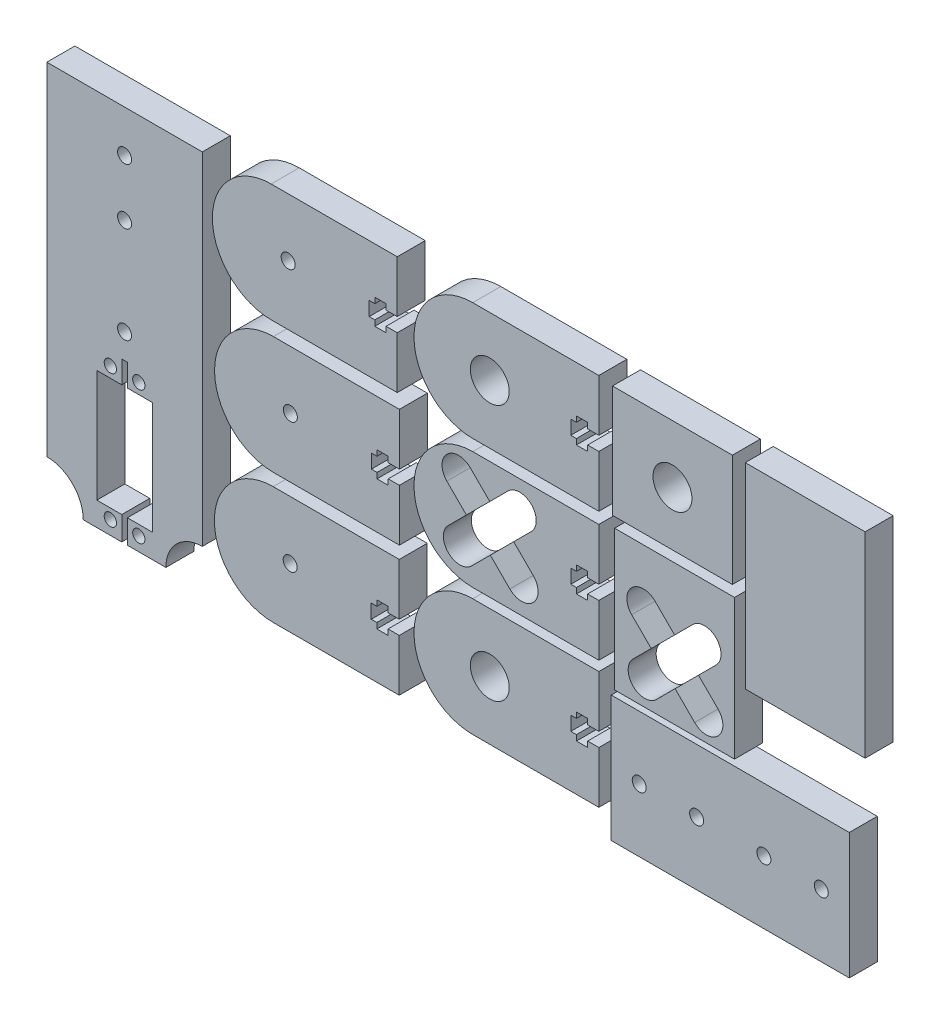
from build123d import *

# Parameters (mm, degrees)
SKETCH1_R              = 2.5
BOSS_EXTRUDE1_DEPTH    = 10
BOSS_EXTRUDE1_2_DEPTH  = 10
SKETCH1_R_2            = 6.95
BOSS_EXTRUDE1_3_DEPTH  = 10
BOSS_EXTRUDE1_4_DEPTH  = 10
BOSS_EXTRUDE1_5_DEPTH  = 10
BOSS_EXTRUDE1_6_DEPTH  = 10
SKETCH1_W              = 42.8
SKETCH1_H              = 50
BOSS_EXTRUDE1_7_DEPTH  = 10
SKETCH1_H_2            = 70
BOSS_EXTRUDE1_8_DEPTH  = 10
SKETCH1_H_3            = 40
BOSS_EXTRUDE1_9_DEPTH  = 10
SKETCH1_W_2            = 85
SKETCH1_H_4            = 45
BOSS_EXTRUDE1_10_DEPTH = 10
SKETCH1_R_3            = 2.19
BOSS_EXTRUDE1_11_DEPTH = 10


with BuildPart() as part:
    # Sketch1 → Boss-Extrude1 (new body)
    with BuildSketch(Plane.XY):
        with BuildLine():
            Line((-4270.805483904, 585.976860365), (-4270.805483904, 604.476860365))
            Line((-4270.805483904, 604.476860365), (-4315.805483904, 604.476860365))
            ThreePointArc((-4315.805483904, 604.476860365), (-4336.805483904, 583.476860365), (-4315.805483904, 562.476860365))
            Line((-4315.805483904, 562.476860365), (-4270.805483904, 562.476860365))
            Line((-4270.805483904, 562.476860365), (-4270.805483904, 580.976860365))
            Line((-4270.805483904, 580.976860365), (-4274.805483904, 580.976860365))
            Line((-4274.805483904, 580.976860365), (-4274.805483904, 578.976860365))
            Line((-4274.805483904, 578.976860365), (-4278.805483904, 578.976860365))
            Line((-4278.805483904, 578.976860365), (-4278.805483904, 580.976860365))
            Line((-4278.805483904, 580.976860365), (-4280.805483904, 580.976860365))
            Line((-4280.805483904, 580.976860365), (-4280.805483904, 585.976860365))
            Line((-4280.805483904, 585.976860365), (-4278.805483904, 585.976860365))
            Line((-4278.805483904, 585.976860365), (-4278.805483904, 587.976860365))
            Line((-4278.805483904, 587.976860365), (-4274.805483904, 587.976860365))
            Line((-4274.805483904, 587.976860365), (-4274.805483904, 585.976860365))
            Line((-4274.805483904, 585.976860365), (-4270.805483904, 585.976860365))
        make_face()
        with Locations((-4309.745473652, 583.748632957)):
            Circle(SKETCH1_R, mode=Mode.SUBTRACT)
    extrude(amount=BOSS_EXTRUDE1_DEPTH)


with BuildPart() as body_2:
    # Sketch1 → Boss-Extrude1 2 (new body)
    with BuildSketch(Plane.XY):
        with BuildLine():
            Line((-4199.541820516, 632.427781583), (-4199.541820516, 650.927781583))
            Line((-4199.541820516, 650.927781583), (-4244.541820516, 650.927781583))
            ThreePointArc((-4244.541820516, 650.927781583), (-4265.541820516, 629.927781583), (-4244.541820516, 608.927781583))
            Line((-4244.541820516, 608.927781583), (-4199.541820516, 608.927781583))
            Line((-4199.541820516, 608.927781583), (-4199.541820516, 627.427781583))
            Line((-4199.541820516, 627.427781583), (-4203.541820516, 627.427781583))
            Line((-4203.541820516, 627.427781583), (-4203.541820516, 625.427781583))
            Line((-4203.541820516, 625.427781583), (-4207.541820516, 625.427781583))
            Line((-4207.541820516, 625.427781583), (-4207.541820516, 627.427781583))
            Line((-4207.541820516, 627.427781583), (-4209.541820516, 627.427781583))
            Line((-4209.541820516, 627.427781583), (-4209.541820516, 632.427781583))
            Line((-4209.541820516, 632.427781583), (-4207.541820516, 632.427781583))
            Line((-4207.541820516, 632.427781583), (-4207.541820516, 634.427781583))
            Line((-4207.541820516, 634.427781583), (-4203.541820516, 634.427781583))
            Line((-4203.541820516, 634.427781583), (-4203.541820516, 632.427781583))
            Line((-4203.541820516, 632.427781583), (-4199.541820516, 632.427781583))
        make_face()
        with BuildLine():
            Line((-4253.331052668, 623.694171788), (-4246.825670282, 630.199554175))
            Line((-4246.825670282, 630.199554175), (-4253.80225912, 637.176143013))
            ThreePointArc((-4253.80225912, 637.176143013), (-4253.80225912, 645.520003031), (-4245.458399102, 645.520003031))
            Line((-4245.458399102, 645.520003031), (-4238.481810264, 638.543414193))
            Line((-4238.481810264, 638.543414193), (-4231.976427877, 645.048796579))
            ThreePointArc((-4231.976427877, 645.048796579), (-4223.632567859, 645.048796579), (-4223.632567859, 636.704936561))
            Line((-4223.632567859, 636.704936561), (-4229.943050225, 630.394454195))
            Line((-4229.943050225, 630.394454195), (-4222.966461387, 623.417865356))
            ThreePointArc((-4222.966461387, 623.417865356), (-4222.966461387, 615.074005338), (-4231.310321405, 615.074005338))
            Line((-4231.310321405, 615.074005338), (-4238.286910243, 622.050594177))
            Line((-4238.286910243, 622.050594177), (-4244.79229263, 615.54521179))
            ThreePointArc((-4244.79229263, 615.54521179), (-4253.232437779, 615.249420905), (-4253.331052668, 623.694171788))
        make_face(mode=Mode.SUBTRACT)
    extrude(amount=BOSS_EXTRUDE1_2_DEPTH)


with BuildPart() as body_3:
    # Sketch1 → Boss-Extrude1 3 (new body)
    with BuildSketch(Plane.XY):
        with BuildLine():
            Line((-4199.541820516, 586.942865006), (-4199.541820516, 605.442865006))
            Line((-4199.541820516, 605.442865006), (-4244.541820516, 605.442865006))
            ThreePointArc((-4244.541820516, 605.442865006), (-4265.541820516, 584.442865006), (-4244.541820516, 563.442865006))
            Line((-4244.541820516, 563.442865006), (-4199.541820516, 563.442865006))
            Line((-4199.541820516, 563.442865006), (-4199.541820516, 581.942865006))
            Line((-4199.541820516, 581.942865006), (-4203.541820516, 581.942865006))
            Line((-4203.541820516, 581.942865006), (-4203.541820516, 579.942865006))
            Line((-4203.541820516, 579.942865006), (-4207.541820516, 579.942865006))
            Line((-4207.541820516, 579.942865006), (-4207.541820516, 581.942865006))
            Line((-4207.541820516, 581.942865006), (-4209.541820516, 581.942865006))
            Line((-4209.541820516, 581.942865006), (-4209.541820516, 586.942865006))
            Line((-4209.541820516, 586.942865006), (-4207.541820516, 586.942865006))
            Line((-4207.541820516, 586.942865006), (-4207.541820516, 588.942865006))
            Line((-4207.541820516, 588.942865006), (-4203.541820516, 588.942865006))
            Line((-4203.541820516, 588.942865006), (-4203.541820516, 586.942865006))
            Line((-4203.541820516, 586.942865006), (-4199.541820516, 586.942865006))
        make_face()
        with Locations((-4238.481810264, 584.442865006)):
            Circle(SKETCH1_R_2, mode=Mode.SUBTRACT)
    extrude(amount=BOSS_EXTRUDE1_3_DEPTH)


with BuildPart() as body_4:
    # Sketch1 → Boss-Extrude1 4 (new body)
    with BuildSketch(Plane.XY):
        with BuildLine():
            Line((-4199.541820516, 678.492149867), (-4199.541820516, 696.992149867))
            Line((-4199.541820516, 696.992149867), (-4244.541820516, 696.992149867))
            ThreePointArc((-4244.541820516, 696.992149867), (-4265.541820516, 675.992149867), (-4244.541820516, 654.992149867))
            Line((-4244.541820516, 654.992149867), (-4199.541820516, 654.992149867))
            Line((-4199.541820516, 654.992149867), (-4199.541820516, 673.492149867))
            Line((-4199.541820516, 673.492149867), (-4203.541820516, 673.492149867))
            Line((-4203.541820516, 673.492149867), (-4203.541820516, 671.492149867))
            Line((-4203.541820516, 671.492149867), (-4207.541820516, 671.492149867))
            Line((-4207.541820516, 671.492149867), (-4207.541820516, 673.492149867))
            Line((-4207.541820516, 673.492149867), (-4209.541820516, 673.492149867))
            Line((-4209.541820516, 673.492149867), (-4209.541820516, 678.492149867))
            Line((-4209.541820516, 678.492149867), (-4207.541820516, 678.492149867))
            Line((-4207.541820516, 678.492149867), (-4207.541820516, 680.492149867))
            Line((-4207.541820516, 680.492149867), (-4203.541820516, 680.492149867))
            Line((-4203.541820516, 680.492149867), (-4203.541820516, 678.492149867))
            Line((-4203.541820516, 678.492149867), (-4199.541820516, 678.492149867))
        make_face()
        with Locations((-4238.481810264, 675.992149867)):
            Circle(SKETCH1_R_2, mode=Mode.SUBTRACT)
    extrude(amount=BOSS_EXTRUDE1_4_DEPTH)


with BuildPart() as body_5:
    # Sketch1 → Boss-Extrude1 5 (new body)
    with BuildSketch(Plane.XY):
        with BuildLine():
            Line((-4271.522624045, 679.205078781), (-4271.522624045, 697.705078781))
            Line((-4271.522624045, 697.705078781), (-4316.522624045, 697.705078781))
            ThreePointArc((-4316.522624045, 697.705078781), (-4337.522624045, 676.705078781), (-4316.522624045, 655.705078781))
            Line((-4316.522624045, 655.705078781), (-4271.522624045, 655.705078781))
            Line((-4271.522624045, 655.705078781), (-4271.522624045, 674.205078781))
            Line((-4271.522624045, 674.205078781), (-4275.522624045, 674.205078781))
            Line((-4275.522624045, 674.205078781), (-4275.522624045, 672.205078781))
            Line((-4275.522624045, 672.205078781), (-4279.522624045, 672.205078781))
            Line((-4279.522624045, 672.205078781), (-4279.522624045, 674.205078781))
            Line((-4279.522624045, 674.205078781), (-4281.522624045, 674.205078781))
            Line((-4281.522624045, 674.205078781), (-4281.522624045, 679.205078781))
            Line((-4281.522624045, 679.205078781), (-4279.522624045, 679.205078781))
            Line((-4279.522624045, 679.205078781), (-4279.522624045, 681.205078781))
            Line((-4279.522624045, 681.205078781), (-4275.522624045, 681.205078781))
            Line((-4275.522624045, 681.205078781), (-4275.522624045, 679.205078781))
            Line((-4275.522624045, 679.205078781), (-4271.522624045, 679.205078781))
        make_face()
        with Locations((-4310.462613793, 676.976851373)):
            Circle(SKETCH1_R, mode=Mode.SUBTRACT)
    extrude(amount=BOSS_EXTRUDE1_5_DEPTH)


with BuildPart() as body_6:
    # Sketch1 → Boss-Extrude1 6 (new body)
    with BuildSketch(Plane.XY):
        with BuildLine():
            Line((-4270.748131446, 632.417025014), (-4270.748131446, 650.917025014))
            Line((-4270.748131446, 650.917025014), (-4315.748131446, 650.917025014))
            ThreePointArc((-4315.748131446, 650.917025014), (-4336.748131446, 629.917025014), (-4315.748131446, 608.917025014))
            Line((-4315.748131446, 608.917025014), (-4270.748131446, 608.917025014))
            Line((-4270.748131446, 608.917025014), (-4270.748131446, 627.417025014))
            Line((-4270.748131446, 627.417025014), (-4274.748131446, 627.417025014))
            Line((-4274.748131446, 627.417025014), (-4274.748131446, 625.417025014))
            Line((-4274.748131446, 625.417025014), (-4278.748131446, 625.417025014))
            Line((-4278.748131446, 625.417025014), (-4278.748131446, 627.417025014))
            Line((-4278.748131446, 627.417025014), (-4280.748131446, 627.417025014))
            Line((-4280.748131446, 627.417025014), (-4280.748131446, 632.417025014))
            Line((-4280.748131446, 632.417025014), (-4278.748131446, 632.417025014))
            Line((-4278.748131446, 632.417025014), (-4278.748131446, 634.417025014))
            Line((-4278.748131446, 634.417025014), (-4274.748131446, 634.417025014))
            Line((-4274.748131446, 634.417025014), (-4274.748131446, 632.417025014))
            Line((-4274.748131446, 632.417025014), (-4270.748131446, 632.417025014))
        make_face()
        with Locations((-4309.688121194, 630.188797606)):
            Circle(SKETCH1_R, mode=Mode.SUBTRACT)
    extrude(amount=BOSS_EXTRUDE1_6_DEPTH)


with BuildPart() as body_7:
    # Sketch1 → Boss-Extrude1 7 (new body)
    with BuildSketch(Plane.XY):
        with Locations((-4172.494925728, 627.573169581)):
            Rectangle(SKETCH1_W, SKETCH1_H)
        with BuildLine():
            Line((-4187.344168133, 615.407787194), (-4180.838785746, 621.913169581))
            Line((-4180.838785746, 621.913169581), (-4187.815374584, 628.889758419))
            ThreePointArc((-4187.815374584, 628.889758419), (-4187.815374584, 637.233618437), (-4179.471514566, 637.233618437))
            Line((-4179.471514566, 637.233618437), (-4172.494925728, 630.257029599))
            Line((-4172.494925728, 630.257029599), (-4165.989543341, 636.762411986))
            ThreePointArc((-4165.989543341, 636.762411986), (-4157.645683323, 636.762411986), (-4157.645683323, 628.418551968))
            Line((-4157.645683323, 628.418551968), (-4163.956165689, 622.108069601))
            Line((-4163.956165689, 622.108069601), (-4156.979576851, 615.131480763))
            ThreePointArc((-4156.979576851, 615.131480763), (-4156.979576851, 606.787620745), (-4165.323436869, 606.787620745))
            Line((-4165.323436869, 606.787620745), (-4172.300025707, 613.764209583))
            Line((-4172.300025707, 613.764209583), (-4178.805408094, 607.258827196))
            ThreePointArc((-4178.805408094, 607.258827196), (-4187.245553243, 606.963036311), (-4187.344168133, 615.407787194))
        make_face(mode=Mode.SUBTRACT)
    extrude(amount=BOSS_EXTRUDE1_7_DEPTH)


with BuildPart() as body_8:
    # Sketch1 → Boss-Extrude1 8 (new body)
    with BuildSketch(Plane.XY):
        with Locations((-4125.858321299, 661.181453687)):
            Rectangle(SKETCH1_W, SKETCH1_H_2)
    extrude(amount=BOSS_EXTRUDE1_8_DEPTH)


with BuildPart() as body_9:
    # Sketch1 → Boss-Extrude1 9 (new body)
    with BuildSketch(Plane.XY):
        with Locations((-4173.256578669, 676.185465686)):
            Rectangle(SKETCH1_W, SKETCH1_H_3)
        with Locations((-4173.256578669, 675.525465686)):
            Circle(SKETCH1_R_2, mode=Mode.SUBTRACT)
    extrude(amount=BOSS_EXTRUDE1_9_DEPTH)


with BuildPart() as body_10:
    # Sketch1 → Boss-Extrude1 10 (new body)
    with BuildSketch(Plane.XY):
        with Locations((-4152.61786464, 577.889071823)):
            Rectangle(SKETCH1_W_2, SKETCH1_H_4)
        with Locations((-4185.11786464, 577.889071823)):
            Circle(SKETCH1_R, mode=Mode.SUBTRACT)
        with Locations((-4164.61786464, 577.889071823)):
            Circle(SKETCH1_R, mode=Mode.SUBTRACT)
        with Locations((-4140.61786464, 577.889071823)):
            Circle(SKETCH1_R, mode=Mode.SUBTRACT)
        with Locations((-4120.11786464, 577.889071823)):
            Circle(SKETCH1_R, mode=Mode.SUBTRACT)
    extrude(amount=BOSS_EXTRUDE1_10_DEPTH)


with BuildPart() as body_11:
    # Sketch1 → Boss-Extrude1 11 (new body)
    with BuildSketch(Plane.XY):
        with BuildLine():
            Line((-4341.12338636, 695.32370632), (-4396.623386359, 695.32370632))
            Line((-4396.623386359, 695.32370632), (-4396.623386359, 573.32370632))
            ThreePointArc((-4396.623386359, 573.32370632), (-4387.430998204, 569.516094475), (-4383.623386359, 560.32370632))
            Line((-4383.623386359, 560.32370632), (-4369.873386359, 560.32370632))
            Line((-4369.873386359, 560.32370632), (-4369.873386359, 568.82370632))
            Line((-4369.873386359, 568.82370632), (-4378.783386359, 568.82370632))
            Line((-4378.783386359, 568.82370632), (-4378.783386359, 608.92370632))
            Line((-4378.783386359, 608.92370632), (-4369.873386359, 608.92370632))
            Line((-4369.873386359, 608.92370632), (-4369.873386359, 616.92370632))
            Line((-4369.873386359, 616.92370632), (-4367.873386359, 616.92370632))
            Line((-4367.873386359, 616.92370632), (-4367.873386359, 608.92370632))
            Line((-4367.873386359, 608.92370632), (-4358.963386359, 608.92370632))
            Line((-4358.963386359, 608.92370632), (-4358.963386359, 568.82370632))
            Line((-4358.963386359, 568.82370632), (-4367.873386359, 568.82370632))
            Line((-4367.873386359, 568.82370632), (-4367.873386359, 560.32370632))
            Line((-4367.873386359, 560.32370632), (-4354.123386359, 560.32370632))
            ThreePointArc((-4354.123386359, 560.32370632), (-4350.315774515, 569.516094475), (-4341.12338636, 573.32370632))
            Line((-4341.12338636, 573.32370632), (-4341.12338636, 695.32370632))
        make_face()
        with Locations((-4373.958386359, 565.23370632)):
            Circle(SKETCH1_R_3, mode=Mode.SUBTRACT)
        with Locations((-4363.788386359, 565.23370632)):
            Circle(SKETCH1_R_3, mode=Mode.SUBTRACT)
        with Locations((-4373.958386359, 612.73370632)):
            Circle(SKETCH1_R_3, mode=Mode.SUBTRACT)
        with Locations((-4363.788386359, 612.73370632)):
            Circle(SKETCH1_R_3, mode=Mode.SUBTRACT)
        with Locations((-4368.873386359, 625.82370632)):
            Circle(SKETCH1_R, mode=Mode.SUBTRACT)
        with Locations((-4368.873386359, 660.32370632)):
            Circle(SKETCH1_R, mode=Mode.SUBTRACT)
        with Locations((-4368.873386359, 680.32370632)):
            Circle(SKETCH1_R, mode=Mode.SUBTRACT)
    extrude(amount=BOSS_EXTRUDE1_11_DEPTH)


solid = Compound([part.part, body_2.part, body_3.part, body_4.part, body_5.part, body_6.part, body_7.part, body_8.part, body_9.part, body_10.part, body_11.part])
